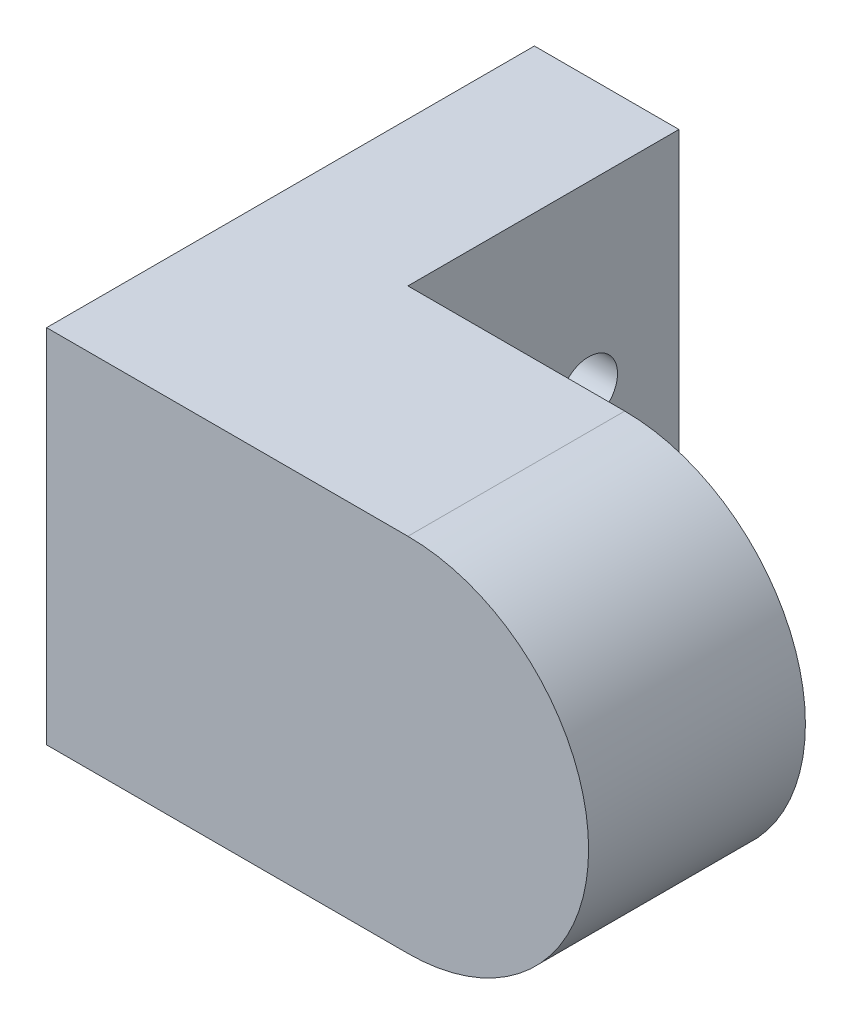
from build123d import *

# Parameters (mm, degrees)
ESBO_O1_R                  = 4
RESSALTO_EXTRUS_O1_DEPTH   = 25
CORTE_EXTRUS_O1_DEPTH      = 38.749172176
CORTE_EXTRUS_O1_DEPTH_BACK = 38.749172176
ESBO_O2_W                  = 22
ESBO_O2_H                  = 15
ESBO_O3_R                  = 1.6
CORTE_EXTRUS_O2_DEPTH      = 20
RESSALTO_EXTRUS_O3_DEPTH   = 2


with BuildPart() as part:
    # Esboço1 → Ressalto-extrusão1 (new body)
    with BuildSketch(Plane.XY):
        with BuildLine():
            Line((0, 10), (-20, 10))
            Line((-20, 10), (-20, -10))
            Line((-20, -10), (0, -10))
            ThreePointArc((0, -10), (10, 0), (0, 10))
        make_face()
        Circle(ESBO_O1_R, mode=Mode.SUBTRACT)
    extrude(amount=RESSALTO_EXTRUS_O1_DEPTH)

    # Esboço2 → Corte-extrusão1 (cut, two sides: drawn at the far end of the back side and taken through both)
    with BuildSketch(Plane(origin=(0, 10, 0), x_dir=(1, 0, 0), z_dir=(0, 1, 0)).offset(-CORTE_EXTRUS_O1_DEPTH_BACK)):
        with Locations((-1, -7.5)):
            Rectangle(ESBO_O2_W, ESBO_O2_H)
    extrude(amount=CORTE_EXTRUS_O1_DEPTH + CORTE_EXTRUS_O1_DEPTH_BACK, mode=Mode.SUBTRACT)

    # Esboço3 → Corte-extrusão2 (cut)
    with BuildSketch(Plane(origin=(-12, 0, 0), x_dir=(0, 0, -1), z_dir=(1, 0, 0))):
        with Locations((-5, 0)):
            Circle(ESBO_O3_R)
    extrude(amount=-CORTE_EXTRUS_O2_DEPTH, mode=Mode.SUBTRACT)

    # Esboço5 → Ressalto-extrusão3 (add)
    with BuildSketch(Plane.XY.offset(25)):
        with BuildLine():
            Line((0, 10), (-20, 10))
            Line((-20, 10), (-20, -10))
            Line((-20, -10), (0, -10))
            ThreePointArc((0, -10), (10, 0), (0, 10))
        make_face()
    extrude(amount=RESSALTO_EXTRUS_O3_DEPTH)


solid = part.part
